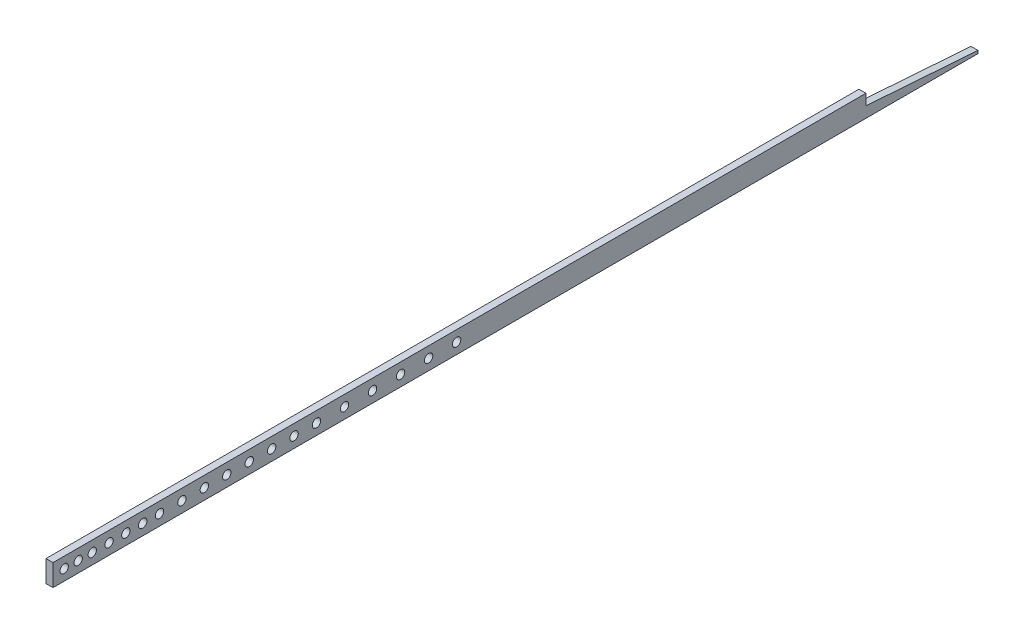
from build123d import *

# Parameters (mm, degrees)
SKIZZE1_W                       = 5
SKIZZE1_H                       = 15.5
GRUNDSTAB_DEPTH                 = 580
AUFSATZ_LINEAR_AUSTRAGEN2_DEPTH = 5
SKIZZE4_R                       = 3
SCHNITT_LINEAR_AUSTRAGEN1_DEPTH = 581.228618736


with BuildPart() as part:
    # Skizze1 → GrundStab (new body)
    with BuildSketch(Plane.XY):
        with Locations((2.5, 7.75)):
            Rectangle(SKIZZE1_W, SKIZZE1_H)
    extrude(amount=GRUNDSTAB_DEPTH)

    # Skizze3 → Aufsatz-Linear austragen2 (add, through all)
    with BuildSketch(Plane.ZY):
        Polygon((0, 7.75), (-80, 2), (-80, 0), (0, 0), align=None)
    extrude(amount=-AUFSATZ_LINEAR_AUSTRAGEN2_DEPTH)

    # Skizze4 → Schnitt-Linear austragen1 (cut, through all)
    with BuildSketch(Plane.ZY):
        with Locations((572, 7.75)):
            Circle(SKIZZE4_R)
        with Locations((562, 7.75)):
            Circle(SKIZZE4_R)
        with Locations((552, 7.75)):
            Circle(SKIZZE4_R)
        with Locations((540, 7.75)):
            Circle(SKIZZE4_R)
        with Locations((528, 7.75)):
            Circle(SKIZZE4_R)
        with Locations((516, 7.75)):
            Circle(SKIZZE4_R)
        with Locations((504, 7.75)):
            Circle(SKIZZE4_R)
        with Locations((488, 7.75)):
            Circle(SKIZZE4_R)
        with Locations((472, 7.75)):
            Circle(SKIZZE4_R)
        with Locations((456, 7.75)):
            Circle(SKIZZE4_R)
        with Locations((440, 7.75)):
            Circle(SKIZZE4_R)
        with Locations((424, 7.75)):
            Circle(SKIZZE4_R)
        with Locations((408, 7.75)):
            Circle(SKIZZE4_R)
        with Locations((392, 7.75)):
            Circle(SKIZZE4_R)
        with Locations((372, 7.75)):
            Circle(SKIZZE4_R)
        with Locations((352, 7.75)):
            Circle(SKIZZE4_R)
        with Locations((332, 7.75)):
            Circle(SKIZZE4_R)
        with Locations((312, 7.75)):
            Circle(SKIZZE4_R)
        with Locations((292, 7.75)):
            Circle(SKIZZE4_R)
    extrude(amount=-SCHNITT_LINEAR_AUSTRAGEN1_DEPTH, mode=Mode.SUBTRACT)


solid = part.part
